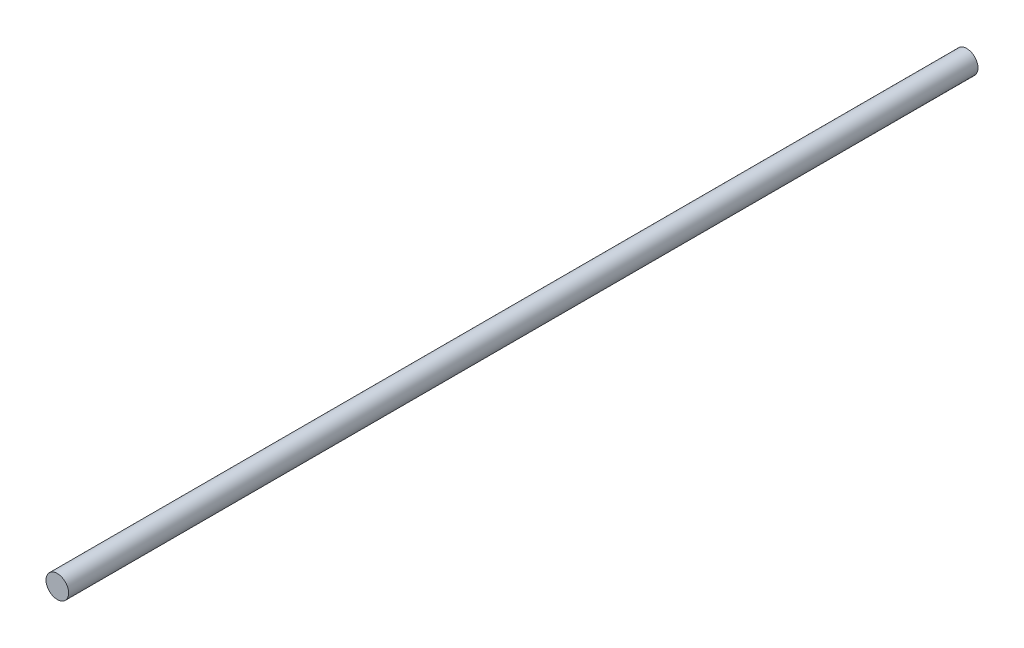
from build123d import *

# Parameters (mm, degrees)
SKETCH1_R           = 6
BOSS_EXTRUDE1_DEPTH = 482.6


with BuildPart() as part:
    # Sketch1 → Boss-Extrude1 (new body)
    with BuildSketch(Plane.XY):
        with Locations(Location((0, 0, 0), (0, 0, 180))):
            Circle(SKETCH1_R)
    extrude(amount=BOSS_EXTRUDE1_DEPTH)


solid = part.part
